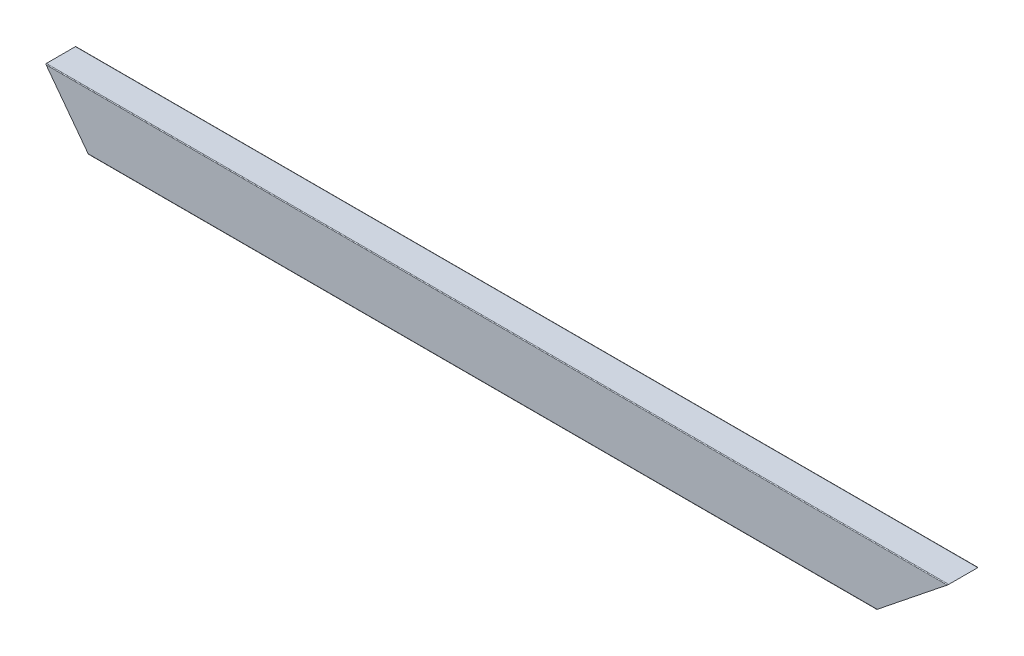
from build123d import *

# Parameters (mm, degrees)
BOSS_EXTRUDE1_DEPTH      = 13.49375
BOSS_EXTRUDE1_DEPTH_BACK = 13.49375
CUT_EXTRUDE1_DEPTH       = 414.750895817
CUT_EXTRUDE1_DEPTH_BACK  = 414.750895817
SKETCH3_W                = 23.6140625
SKETCH3_H                = 47.228125
FILLET1_R                = 1.27
FILLET2_R                = 0.635


with BuildPart() as part:
    # Sketch2 → Boss-Extrude1 (new, two sides: drawn at the far end of the back side and taken through both)
    with BuildSketch(Plane.XY.offset(-BOSS_EXTRUDE1_DEPTH_BACK)):
        Polygon((-349.25, -25.4), (-387.383370876, 25.4), (-349.25, 25.4), (349.25, 25.4), (412.75, 25.4), (349.25, -25.4), align=None)
    extrude(amount=BOSS_EXTRUDE1_DEPTH + BOSS_EXTRUDE1_DEPTH_BACK)

    # Sketch3 → Cut-Extrude1 (cut, two sides: drawn at the far end of the back side and taken through both)
    with BuildSketch(Plane(origin=(0, 0, 0), x_dir=(0, 0, -1), z_dir=(1, 0, 0)).offset(-CUT_EXTRUDE1_DEPTH_BACK)):
        Rectangle(SKETCH3_W, SKETCH3_H)
    extrude(amount=CUT_EXTRUDE1_DEPTH + CUT_EXTRUDE1_DEPTH_BACK, mode=Mode.SUBTRACT)

    # Fillet1
    fillet1_edges = [part.edges().sort_by_distance(p)[0] for p in [
        (0.445897778, -23.6140625, -11.80703125),
        (0.445897778, -23.6140625, 11.80703125),
        (12.237416785, 23.6140625, 11.80703125),
        (12.237416785, 23.6140625, -11.80703125),
    ]]
    fillet(fillet1_edges, radius=FILLET1_R)

    # Fillet2
    fillet2_edges = [part.edges().sort_by_distance(p)[0] for p in [
        (12.683314562, 25.4, 13.49375),
        (0, -25.4, 13.49375),
        (0, -25.4, -13.49375),
        (12.683314562, 25.4, -13.49375),
    ]]
    fillet(fillet2_edges, radius=FILLET2_R)


solid = part.part
